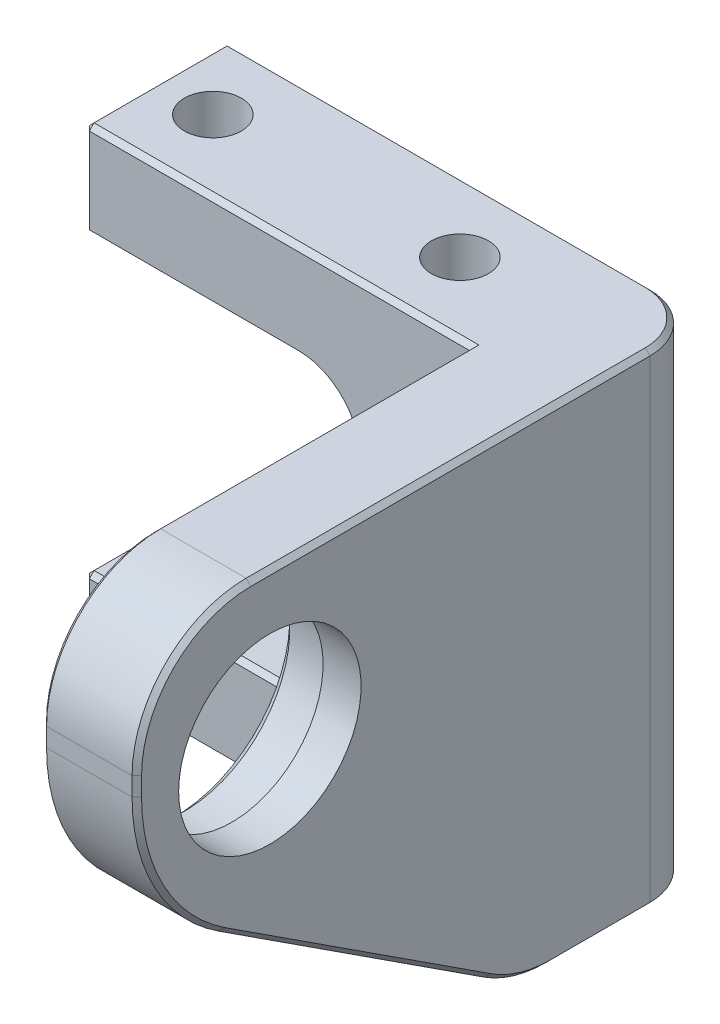
from build123d import *

# Parameters (mm, degrees)
BOSS_EXTRUDE1_DEPTH = 50.8
SKETCH3_R           = 11.1
CUT_EXTRUDE1_DEPTH  = 6
SKETCH4_R           = 9.6
CUT_EXTRUDE2_DEPTH  = 87.597575024
CUT_EXTRUDE3_DEPTH  = 84.529276305
FILLET1_R           = 20
FILLET2_R           = 12
SKETCH6_R           = 3
CUT_EXTRUDE4_DEPTH  = 89.809571556
SKETCH7_W           = 28.5
SKETCH7_H           = 30.8
CUT_EXTRUDE5_DEPTH  = 85.592493757
FILLET3_R           = 6
FILLET4_R           = 6
FILLET5_R           = 12
CHAMFER1_SIZE       = 0.5
CHAMFER2_SIZE       = 1


with BuildPart() as part:
    # Sketch2 → Boss-Extrude1 (new body)
    with BuildSketch(Plane(origin=(0, 0, 0), x_dir=(1, 0, 0), z_dir=(0, 1, 0))):
        Polygon((0, 7.5), (50.5, 7.5), (50.5, -52.5), (40.5, -52.5), (40.5, -7.5), (0, -7.5), align=None)
    extrude(amount=BOSS_EXTRUDE1_DEPTH)

    # Sketch3 → Cut-Extrude1 (cut)
    with BuildSketch(Plane.ZY.offset(-40.5)):
        with Locations((38.5, 35.4)):
            Circle(SKETCH3_R)
    extrude(amount=-CUT_EXTRUDE1_DEPTH, mode=Mode.SUBTRACT)

    # Sketch4 → Cut-Extrude2 (cut, through all)
    with BuildSketch(Plane.ZY.offset(-46.5)):
        with Locations((38.5, 35.4)):
            Circle(SKETCH4_R)
    extrude(amount=-CUT_EXTRUDE2_DEPTH, mode=Mode.SUBTRACT)

    # Sketch5 → Cut-Extrude3 (cut, through all)
    with BuildSketch(Plane.ZY.offset(-40.5)):
        Polygon((12.5, 0), (52.5, 0), (52.5, 26), align=None)
    extrude(amount=-CUT_EXTRUDE3_DEPTH, mode=Mode.SUBTRACT)

    # Fillet1
    fillet1_edges = [part.edges().sort_by_distance(p)[0] for p in [
        (45.5, 26, 52.5),
    ]]
    fillet(fillet1_edges, radius=FILLET1_R)

    # Fillet2
    fillet2_edges = [part.edges().sort_by_distance(p)[0] for p in [
        (45.5, 50.8, 52.5),
    ]]
    fillet(fillet2_edges, radius=FILLET2_R)

    # Sketch6 → Cut-Extrude4 (cut, through all)
    with BuildSketch(Plane(origin=(0, 50.8, 0), x_dir=(1, 0, 0), z_dir=(0, 1, 0))):
        with Locations(Location((6, 0, 0), (0, 0, 270))):
            Circle(SKETCH6_R)
        with Locations(Location((32, 0, 0), (0, 0, 270))):
            Circle(SKETCH6_R)
    extrude(amount=-CUT_EXTRUDE4_DEPTH, mode=Mode.SUBTRACT)

    # Sketch7 → Cut-Extrude5 (cut, through all)
    with BuildSketch(Plane.XY.offset(7.5)):
        with Locations((14.25, 25.4)):
            Rectangle(SKETCH7_W, SKETCH7_H)
    extrude(amount=-CUT_EXTRUDE5_DEPTH, mode=Mode.SUBTRACT)

    # Fillet3
    fillet3_edges = [part.edges().sort_by_distance(p)[0] for p in [
        (28.5, 10, 0),
        (28.5, 40.8, 0),
    ]]
    fillet(fillet3_edges, radius=FILLET3_R)

    # Fillet4
    fillet4_edges = [part.edges().sort_by_distance(p)[0] for p in [
        (50.5, 25.4, -7.5),
    ]]
    fillet(fillet4_edges, radius=FILLET4_R)

    # Fillet5
    fillet5_edges = [part.edges().sort_by_distance(p)[0] for p in [
        (45.5, 0, 12.5),
    ]]
    fillet(fillet5_edges, radius=FILLET5_R)

    # Chamfer1
    chamfer1_edges = [part.edges().sort_by_distance(p)[0] for p in [
        (48.742640687, 0, -5.742640687),
        (50.5, 50.8, 19.5),
        (48.742640687, 50.8, -5.742640687),
        (40.5, 0, 8.221359592),
        (40.5, 0.4948733, 12.353299725),
        (50.5, 0.4948733, 12.353299725),
        (0, 45.8, -7.5),
        (0, 45.8, 7.5),
        (20.25, 50.8, 7.5),
        (0, 50.8, 0),
        (40.5, 11.011762581, 29.441173202),
        (50.5, 11.011762581, 29.441173202),
        (40.5, 27.314206751, 50.07832956),
        (50.5, 27.314206751, 50.07832956),
        (40.5, 37.826860442, 52.5),
        (50.5, 37.826860442, 52.5),
        (40.5, 50.8, 24),
        (22.25, 50.8, -7.5),
        (40.5, 47.285281374, 48.985281374),
        (50.5, 47.285281374, 48.985281374),
        (0, 5, 7.5),
        (0, 0, 0),
        (0, 5, -7.5),
        (20.25, 0, 7.5),
        (0, 40.8, 0),
        (11.25, 10, -7.5),
        (0, 10, 0),
        (11.25, 10, 7.5),
        (11.25, 40.8, 7.5),
        (11.25, 40.8, -7.5),
        (28.5, 25.4, 7.5),
        (28.5, 25.4, -7.5),
        (22.25, 0, -7.5),
        (26.742640687, 39.042640687, 7.5),
        (26.742640687, 39.042640687, -7.5),
        (26.742640687, 11.757359313, 7.5),
        (26.742640687, 11.757359313, -7.5),
        (50.5, 0, 3.721359592),
    ]]
    chamfer(chamfer1_edges, length=CHAMFER1_SIZE)

    # Chamfer2
    chamfer2_edges = [part.edges().sort_by_distance(p)[0] for p in [
        (40.5, 35.4, 27.4),
    ]]
    chamfer(chamfer2_edges, length=CHAMFER2_SIZE)


solid = part.part
